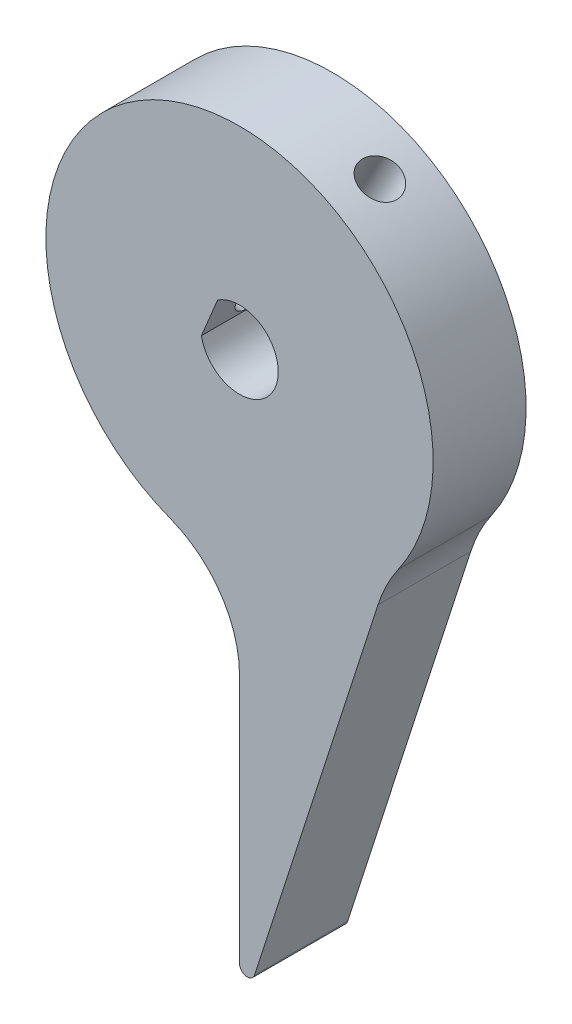
from build123d import *

# Parameters (mm, degrees)
EXTRUDE_1_DEPTH     = 6
FILLET_1_R          = 7
FILLET_2_R          = 10
FILLET_5_R          = 0.5
CUT_EXTRUDE_1_REACH = 39.481
M3X0_5_10_REACH     = 47.736
M3X0_5_10_BORE_R    = 1.25
M3X0_5_9_REACH      = 51.752
M3X0_5_9_BORE_R     = 1.25


with BuildPart() as part:
    # ｽｹｯﾁ1 → ﾎﾞｽ - 押し出し1 (new body)
    with BuildSketch(Plane.XY):
        with BuildLine():
            Line((0, -12.5), (0, -37.5))
            Line((0, -37.5), (9.46282016, -8.167315019))
            ThreePointArc((9.46282016, -8.167315019), (-5.203775661, 11.365329686), (0, -12.5))
        make_face()
    extrude(amount=EXTRUDE_1_DEPTH)

    # ﾌｨﾚｯﾄ1
    fillet_1_edges = [part.edges().sort_by_distance(p)[0] for p in [
        (0, -12.5, 3),
    ]]
    fillet(fillet_1_edges, radius=FILLET_1_R)

    # ﾌｨﾚｯﾄ2
    fillet_2_edges = [part.edges().sort_by_distance(p)[0] for p in [
        (9.46282016, -8.167315019, 3),
    ]]
    fillet(fillet_2_edges, radius=FILLET_2_R)

    # ﾌｨﾚｯﾄ5
    fillet_5_edges = [part.edges().sort_by_distance(p)[0] for p in [
        (0, -37.5, 3),
    ]]
    fillet(fillet_5_edges, radius=FILLET_5_R)

    # ｽｹｯﾁ2 → ｶｯﾄ - 押し出し1 (cut, up to next)
    with BuildSketch(Plane(origin=(0, 0, 0), x_dir=(-1, 0, 0), z_dir=(0, 0, -1)), mode=Mode.PRIVATE) as cut_extrude_1_sk1:
        with BuildLine():
            Line((1.419037816, 2.058235088), (2.459682561, -0.447170771))
            ThreePointArc((2.459682561, -0.447170771), (-2.308762129, -0.958966855), (1.419037816, 2.058235088))
        make_face()
    cut_extrude_1_tool1 = extrude(cut_extrude_1_sk1.sketch, amount=-CUT_EXTRUDE_1_REACH, mode=Mode.PRIVATE) & part.part
    add(cut_extrude_1_tool1.solids().sort_by_distance((0.081308, -0.033772, 0))[0], mode=Mode.SUBTRACT)

    # M3x0.5 ねじ穴10 bore → M3x0.5 ねじ穴10 (cut, up to next)
    with BuildSketch(Plane(origin=(-12.058562703, 3.292577338, 6), x_dir=(0, 0, 1), z_dir=(-0.9646850162772109, 0.2634061870386444, 0)), mode=Mode.PRIVATE) as m3x0_5_10_sk1:
        with Locations((-2.997210871, 0.245482714)):
            Circle(M3X0_5_10_BORE_R)
    m3x0_5_10_tool1 = extrude(m3x0_5_10_sk1.sketch, amount=-M3X0_5_10_REACH, mode=Mode.PRIVATE) & part.part
    add(m3x0_5_10_tool1.solids().sort_by_distance((-11.993901, 3.529391, 3.002789))[0], mode=Mode.SUBTRACT)

    # M3x0.5 ねじ穴9 bore → M3x0.5 ねじ穴9 (cut, up to next)
    with BuildSketch(Plane(origin=(5.958781535, 10.988308451, 0), x_dir=(0.8790646760735905, -0.47670252283749615, 0), z_dir=(0.4767025228374961, 0.8790646760735904, 0)), mode=Mode.PRIVATE) as m3x0_5_9_sk1:
        with Locations((0, -2.885627833)):
            Circle(M3X0_5_9_BORE_R)
    m3x0_5_9_tool1 = extrude(m3x0_5_9_sk1.sketch, amount=-M3X0_5_9_REACH, mode=Mode.PRIVATE) & part.part
    add(m3x0_5_9_tool1.solids().sort_by_distance((5.958782, 10.988308, 2.885628))[0], mode=Mode.SUBTRACT)


solid = part.part
